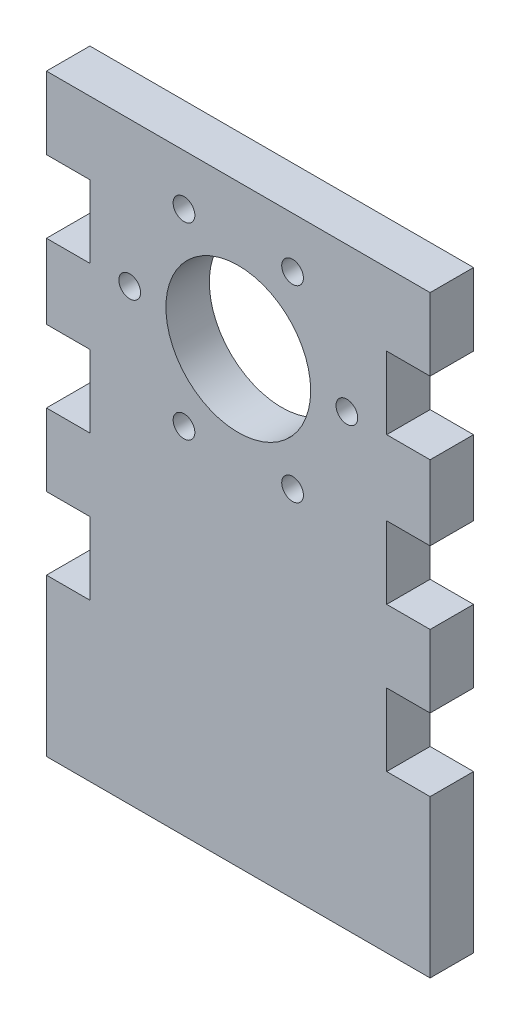
from build123d import *

# Parameters (mm, degrees)
SKETCH1_R           = 5
SKETCH1_R_2         = 0.75
BOSS_EXTRUDE1_DEPTH = 3


with BuildPart() as part:
    # Sketch1 → Boss-Extrude1 (new body)
    with BuildSketch(Plane.XY):
        Polygon((-13.25, 15.5), (-10.25, 15.5), (-10.25, 10.5), (-13.25, 10.5), (-13.25, 5.35), (-10.25, 5.35), (-10.25, 0.35), (-13.25, 0.35), (-13.25, -4.65), (-10.25, -4.65), (-10.25, -9.65), (-13.25, -9.65), (-13.25, -20.5), (13.25, -20.5), (13.25, -9.65), (10.25, -9.65), (10.25, -4.65), (13.25, -4.65), (13.25, 0.35), (10.25, 0.35), (10.25, 5.35), (13.25, 5.35), (13.25, 10.5), (10.25, 10.5), (10.25, 15.5), (13.25, 15.5), (13.25, 20.5), (-13.25, 20.5), align=None)
        with Locations((0, 10.5)):
            Circle(SKETCH1_R, mode=Mode.SUBTRACT)
        with Locations((3.75, 16.995190528)):
            Circle(SKETCH1_R_2, mode=Mode.SUBTRACT)
        with Locations((7.499999997, 10.499776304)):
            Circle(SKETCH1_R_2, mode=Mode.SUBTRACT)
        with Locations((3.75, 4.004809472)):
            Circle(SKETCH1_R_2, mode=Mode.SUBTRACT)
        with Locations((-3.75, 4.004809472)):
            Circle(SKETCH1_R_2, mode=Mode.SUBTRACT)
        with Locations((-7.499999997, 10.500223696)):
            Circle(SKETCH1_R_2, mode=Mode.SUBTRACT)
        with Locations((-3.75, 16.995190528)):
            Circle(SKETCH1_R_2, mode=Mode.SUBTRACT)
    extrude(amount=BOSS_EXTRUDE1_DEPTH)


solid = part.part
